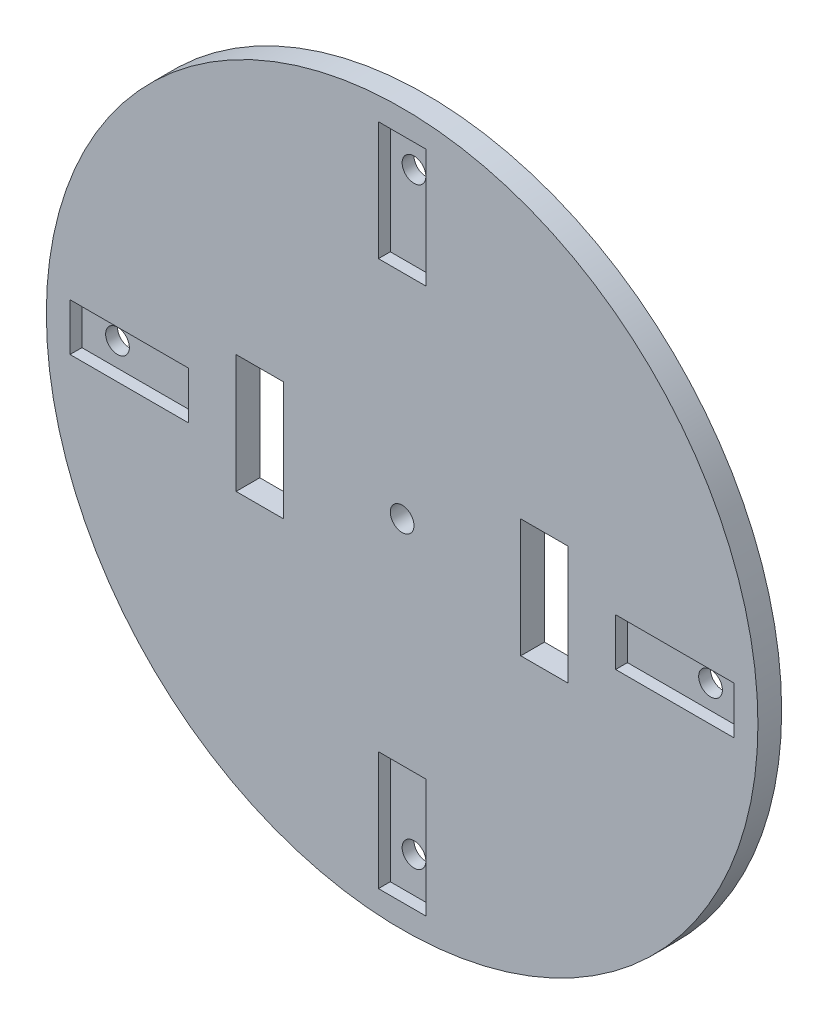
from build123d import *

# Parameters (mm, degrees)
SKETCH_1_R               = 150
SKETCH_1_R_2             = 5
EXTRUDE_1_DEPTH          = 10
SKETCH_2_W               = 50
SKETCH_2_H               = 20
SKETCH_2_W_2             = 20
SKETCH_2_H_2             = 50
CUT_EXTRUDE_1_DEPTH      = 5
SKETCH_4_R               = 5
CUT_EXTRUDE_3_DEPTH      = 229.048761054
CUT_EXTRUDE_4_DEPTH      = 229.213140327
CUT_EXTRUDE_4_DEPTH_BACK = 229.213140327
SKETCH_3_W               = 20
SKETCH_3_H               = 50


with BuildPart() as part:
    # 草图1 → 凸台-拉伸1 (new body)
    with BuildSketch(Plane.XY):
        with Locations((-15.39076342, 6.930343762)):
            Circle(SKETCH_1_R)
        with Locations((-15.39076342, 6.930343762)):
            Circle(SKETCH_1_R_2, mode=Mode.SUBTRACT)
    extrude(amount=EXTRUDE_1_DEPTH)

    # 草图2 → 切除-拉伸1 (cut)
    with BuildSketch(Plane.XY.offset(10)):
        with Locations((99.60923658, 6.930343762)):
            Rectangle(SKETCH_2_W, SKETCH_2_H)
        with Locations((-15.39076342, 121.930343762)):
            Rectangle(SKETCH_2_W_2, SKETCH_2_H_2)
        with Locations((-15.39076342, -108.069656238)):
            Rectangle(SKETCH_2_W_2, SKETCH_2_H_2)
        with Locations((-130.39076342, 6.930343762)):
            Rectangle(SKETCH_2_W, SKETCH_2_H)
    extrude(amount=-CUT_EXTRUDE_1_DEPTH, mode=Mode.SUBTRACT)

    # 草图4 → 切除-拉伸3 (cut, through all)
    with BuildSketch(Plane.XY.offset(5)):
        with Locations((109.60923658, 6.930343762)):
            Circle(SKETCH_4_R)
        with Locations((-15.39076342, -118.069656238)):
            Circle(SKETCH_4_R)
        with Locations((-140.39076342, 6.930343762)):
            Circle(SKETCH_4_R)
        with Locations((-15.39076342, 131.930343762)):
            Circle(SKETCH_4_R)
    extrude(amount=-CUT_EXTRUDE_3_DEPTH, mode=Mode.SUBTRACT)

    # 草图3 → 切除-拉伸4 (cut, two sides: drawn at the far end of the back side and taken through both)
    with BuildSketch(Plane.XY.offset(10).offset(-CUT_EXTRUDE_4_DEPTH_BACK)):
        with Locations((44.60923658, 6.930343762)):
            Rectangle(SKETCH_3_W, SKETCH_3_H)
        with Locations((-75.39076342, 6.930343762)):
            Rectangle(SKETCH_3_W, SKETCH_3_H)
    extrude(amount=CUT_EXTRUDE_4_DEPTH + CUT_EXTRUDE_4_DEPTH_BACK, mode=Mode.SUBTRACT)


solid = part.part
